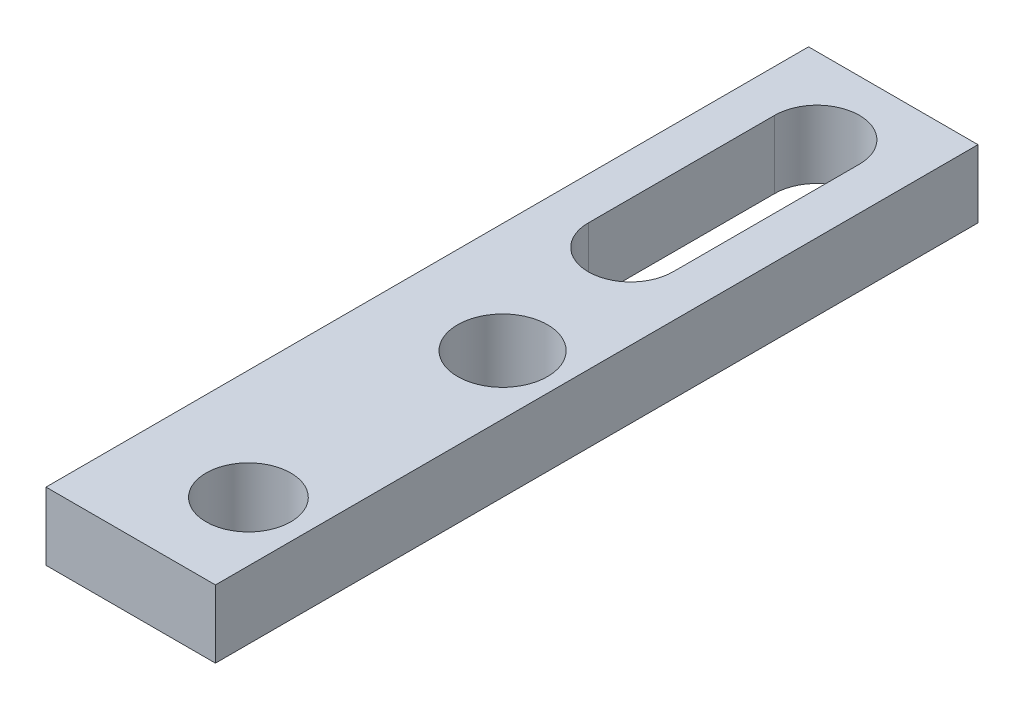
from build123d import *

# Parameters (mm, degrees)
SKETCH_1_W      = 10
SKETCH_1_H      = 45
SKETCH_1_R      = 2.653323097
SKETCH_1_R_2    = 2.5
EXTRUDE_1_DEPTH = 4


with BuildPart() as part:
    # 草圖1 → 填料-伸長1 (new body)
    with BuildSketch(Plane(origin=(0, 0, 0), x_dir=(1, 0, 0), z_dir=(0, 1, 0))):
        Rectangle(SKETCH_1_W, SKETCH_1_H)
        with Locations(Location((1.5, -2.055555556, 0), (0, 0, 270))):
            Circle(SKETCH_1_R, mode=Mode.SUBTRACT)
        with Locations(Location((1.5, -17.055555556, 0), (0, 0, 270))):
            Circle(SKETCH_1_R_2, mode=Mode.SUBTRACT)
        with BuildLine():
            Line((2.5, 18), (2.5, 7))
            ThreePointArc((2.5, 7), (0, 4.5), (-2.5, 7))
            Line((-2.5, 7), (-2.5, 18))
            ThreePointArc((-2.5, 18), (0, 20.5), (2.5, 18))
        make_face(mode=Mode.SUBTRACT)
    extrude(amount=EXTRUDE_1_DEPTH)


solid = part.part
